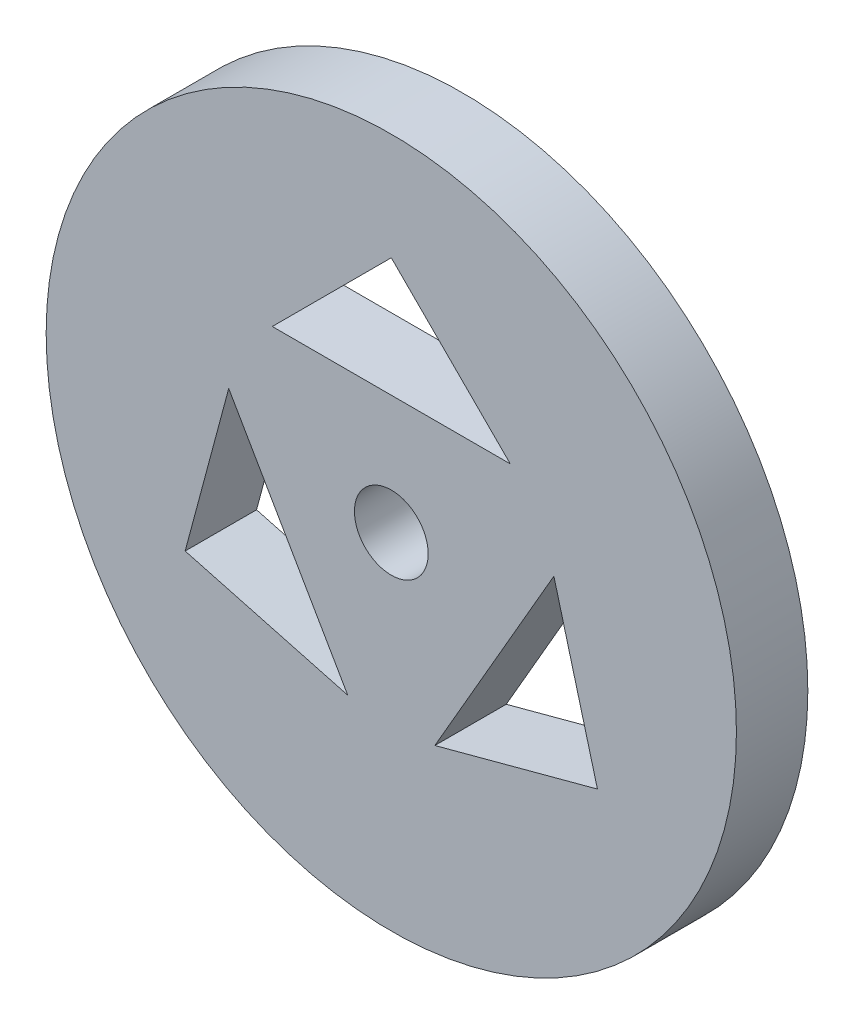
from build123d import *

# Parameters (mm, degrees)
SKETCH_1_R          = 29
EXTRUDE_1_DEPTH     = 6
SKETCH_2_R          = 3.1
CUT_EXTRUDE_1_DEPTH = 42.448763552
CUT_EXTRUDE_2_DEPTH = 42.448763552


with BuildPart() as part:
    # 草图1 → 凸台-拉伸1 (new body)
    with BuildSketch(Plane.XY):
        Circle(SKETCH_1_R)
    extrude(amount=EXTRUDE_1_DEPTH)

    # 草图2 → 切除-拉伸1 (cut, through all)
    with BuildSketch(Plane.XY.offset(6)):
        Circle(SKETCH_2_R)
    extrude(amount=-CUT_EXTRUDE_1_DEPTH, mode=Mode.SUBTRACT)

    # 草图3 → 切除-拉伸2 (cut, through all)
    with BuildSketch(Plane.XY.offset(6)):
        Polygon((-10, 10), (0, 20), (10, 10), align=None)
        Polygon((13.660254038, 3.660254038), (17.320508076, -10), (3.660254038, -13.660254038), align=None)
        Polygon((-3.660254038, -13.660254038), (-17.320508076, -10), (-13.660254038, 3.660254038), align=None)
    extrude(amount=-CUT_EXTRUDE_2_DEPTH, mode=Mode.SUBTRACT)


solid = part.part
